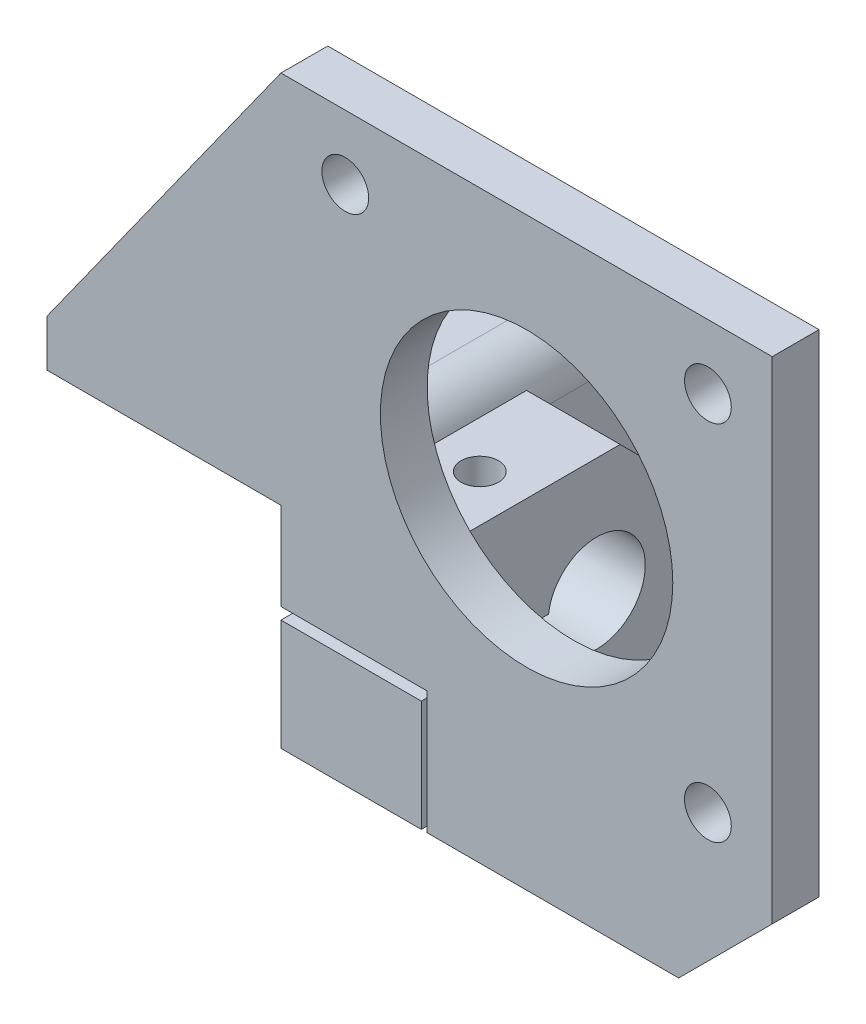
from build123d import *

# Parameters (mm, degrees)
ESBO_O1_R                  = 2
ESBO_O1_R_2                = 12.5
RESSALTO_EXTRUS_O1_DEPTH   = 4
RESSALTO_EXTRUS_O2_DEPTH   = 25
ESBO_O3_R                  = 4.15
RESSALTO_EXTRUS_O3_DEPTH   = 8
CORTE_EXTRUS_O1_DEPTH      = 8
CORTE_EXTRUS_O1_DEPTH_BACK = 8
CORTE_EXTRUS_O2_START      = -12
ESBO_O5_R                  = 1.75
ESBO_O5_R_2                = 4.15
CORTE_EXTRUS_O2_DEPTH      = 12
ESBO_O6_R                  = 1.75
CORTE_EXTRUS_O3_DEPTH      = 12
ESBO_O7_R                  = 1.6
CORTE_EXTRUS_O4_DEPTH      = 70.32532005


with BuildPart() as part:
    # Esboço1 → Ressalto-extrusão1 (new body)
    with BuildSketch(Plane.XY):
        Polygon((-21, -11), (-41, -11), (-41, -7), (-21, 21), (21, 21), (21, -21), (13, -29), (-21, -29), (-21, -21), align=None)
        with Locations((-15.5, 15.5)):
            Circle(ESBO_O1_R, mode=Mode.SUBTRACT)
        with Locations((15.5, 15.5)):
            Circle(ESBO_O1_R, mode=Mode.SUBTRACT)
        with Locations((15.5, -15.5)):
            Circle(ESBO_O1_R, mode=Mode.SUBTRACT)
        Circle(ESBO_O1_R_2, mode=Mode.SUBTRACT)
    extrude(amount=RESSALTO_EXTRUS_O1_DEPTH)

    # Esboço2 → Ressalto-extrusão2 (add)
    with BuildSketch(Plane(origin=(0, 0, 0), x_dir=(-1, 0, 0), z_dir=(0, 0, -1))):
        with BuildLine():
            Line((41, -11), (41, -7))
            Line((41, -7), (21, -7))
            ThreePointArc((21, -7), (18.171572875, -8.171572875), (17, -11))
            Line((17, -11), (17, -29))
            Line((17, -29), (21, -29))
            Line((21, -29), (21, -11))
            Line((21, -11), (41, -11))
        make_face()
    extrude(amount=RESSALTO_EXTRUS_O2_DEPTH)

    # Esboço3 → Ressalto-extrusão3 (add)
    with BuildSketch(Plane(origin=(-17, 0, 0), x_dir=(0, 0, -1), z_dir=(1, 0, 0))):
        Polygon((0, -9), (13, -9), (18, -14), (18, -24), (13, -29), (0, -29), align=None)
        with Locations(Location((11, -19, 0), (0, 0, 90))):
            Circle(ESBO_O3_R, mode=Mode.SUBTRACT)
    extrude(amount=RESSALTO_EXTRUS_O3_DEPTH)

    # Esboço4 → Corte-extrusão1 (cut, two sides: drawn at the far end of the back side and taken through both)
    with BuildSketch(Plane(origin=(0, 0, 0), x_dir=(-1, 0, 0), z_dir=(0, 0, -1)).offset(-CORTE_EXTRUS_O1_DEPTH_BACK)):
        Polygon((8.5, -18.5), (21.5, -18.5), (21.5, -26), (21, -29), (21, -19.5), (9, -19.5), (9, -29), (8.5, -29), align=None)
    extrude(amount=CORTE_EXTRUS_O1_DEPTH + CORTE_EXTRUS_O1_DEPTH_BACK, mode=Mode.SUBTRACT)

    # Esboço5 → Corte-extrusão2 (cut)
    with BuildSketch(Plane(origin=(-17, 0, 0), x_dir=(0, 0, -1), z_dir=(1, 0, 0)).offset(CORTE_EXTRUS_O2_START)):
        with Locations(Location((21, -21, 0), (0, 0, 90))):
            Circle(ESBO_O5_R)
        with Locations((11, -19)):
            Circle(ESBO_O5_R_2)
    extrude(amount=CORTE_EXTRUS_O2_DEPTH, mode=Mode.SUBTRACT)

    # Esboço6 → Corte-extrusão3 (cut)
    with BuildSketch(Plane(origin=(0, -7, 0), x_dir=(1, 0, 0), z_dir=(0, 1, 0))):
        with Locations(Location((-31.5, 18, 0), (0, 0, 180))):
            Circle(ESBO_O6_R)
        with Locations(Location((-31.5, -2, 0), (0, 0, 180))):
            Circle(ESBO_O6_R)
    extrude(amount=-CORTE_EXTRUS_O3_DEPTH, mode=Mode.SUBTRACT)

    # Esboço7 → Corte-extrusão4 (cut, through all)
    with BuildSketch(Plane.XZ.offset(29)):
        with Locations(Location((-13, -5, 0), (0, 0, 270))):
            Circle(ESBO_O7_R)
    extrude(amount=-CORTE_EXTRUS_O4_DEPTH, mode=Mode.SUBTRACT)


solid = part.part
